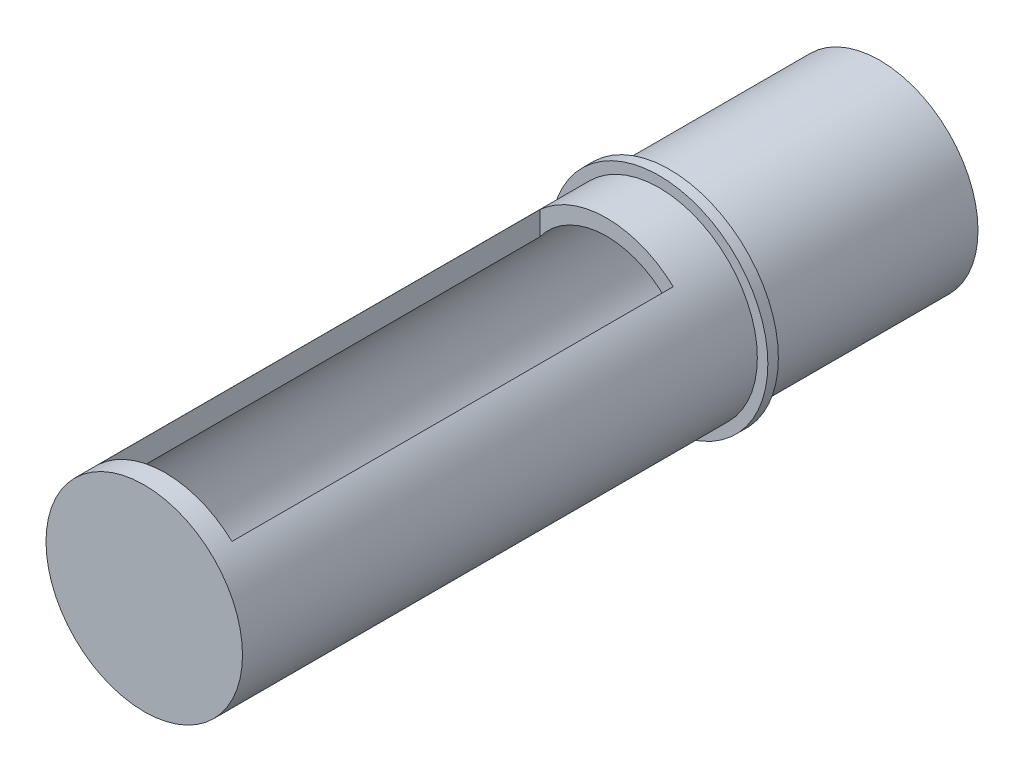
from build123d import *

# Parameters (mm, degrees)
RESSALTO_EXTRUS_O1_DEPTH      = 50
RESSALTO_EXTRUS_O1_DEPTH_BACK = 20
ESBO_O1_R                     = 9.35
ESBO_O1_R_2                   = 7.85
ESBO_O2_R                     = 10.35
ESBO_O2_R_2                   = 9.35
RESSALTO_EXTRUS_O2_DEPTH      = 1
RESSALTO_EXTRUS_O3_START      = -2
ESBO_O3_R                     = 7.85
RESSALTO_EXTRUS_O3_DEPTH      = 2
ESBO_O4_W                     = 12.7
ESBO_O4_H                     = 42
CORTE_EXTRUS_O1_DEPTH         = 21


with BuildPart() as part:
    # Esboço1 → Ressalto-extrusão1 (new, two sides: drawn at the far end of the back side and taken through both)
    with BuildSketch(Plane.XY.offset(-RESSALTO_EXTRUS_O1_DEPTH_BACK)):
        Circle(ESBO_O1_R)
        Circle(ESBO_O1_R_2, mode=Mode.SUBTRACT)
    extrude(amount=RESSALTO_EXTRUS_O1_DEPTH + RESSALTO_EXTRUS_O1_DEPTH_BACK)

    # Esboço2 → Ressalto-extrusão2 (add)
    with BuildSketch(Plane.XY):
        Circle(ESBO_O2_R)
        Circle(ESBO_O2_R_2, mode=Mode.SUBTRACT)
    extrude(amount=RESSALTO_EXTRUS_O2_DEPTH)

    # Esboço3 → Ressalto-extrusão3 (add)
    with BuildSketch(Plane.XY.offset(50).offset(RESSALTO_EXTRUS_O3_START)):
        Circle(ESBO_O3_R)
    extrude(amount=RESSALTO_EXTRUS_O3_DEPTH)

    # Esboço4 → Corte-extrusão1 (cut)
    with BuildSketch(Plane(origin=(0, 0, 0), x_dir=(1, 0, 0), z_dir=(0, 1, 0))):
        with Locations((0, -27)):
            Rectangle(ESBO_O4_W, ESBO_O4_H)
    extrude(amount=CORTE_EXTRUS_O1_DEPTH, mode=Mode.SUBTRACT)


solid = part.part
